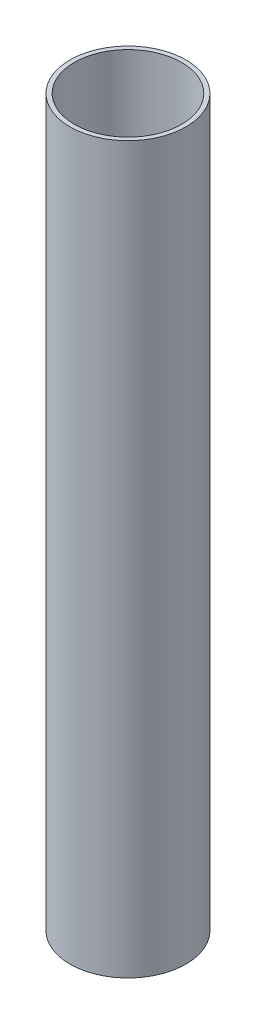
from build123d import *

# Parameters (mm, degrees)
SKETCH1_R           = 16
SKETCH1_R_2         = 14.8
BOSS_EXTRUDE1_DEPTH = 200


with BuildPart() as part:
    # Sketch1 → Boss-Extrude1 (new body)
    with BuildSketch(Plane(origin=(0, 0, 0), x_dir=(1, 0, 0), z_dir=(0, 1, 0))):
        with Locations(Location((0, 0, 0), (0, 0, 270))):
            Circle(SKETCH1_R)
        with Locations(Location((0, 0, 0), (0, 0, 270))):
            Circle(SKETCH1_R_2, mode=Mode.SUBTRACT)
    extrude(amount=BOSS_EXTRUDE1_DEPTH)


solid = part.part
